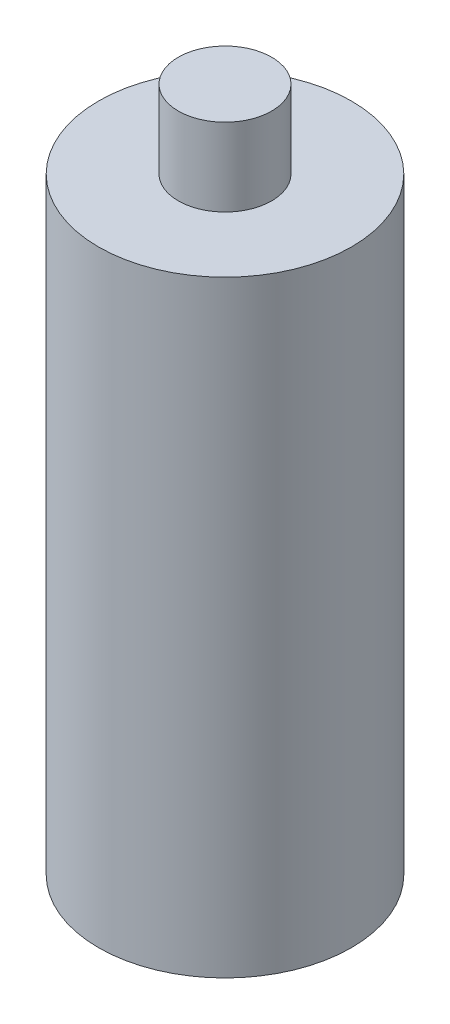
from build123d import *

# Parameters (mm, degrees)
SKETCH_1_R      = 3.25
EXTRUDE_1_DEPTH = 15.6
SKETCH_2_R      = 1.2
EXTRUDE_2_DEPTH = 2


with BuildPart() as part:
    # 草图1 → 凸台-拉伸1 (new body)
    with BuildSketch(Plane(origin=(0, 0, 0), x_dir=(1, 0, 0), z_dir=(0, 1, 0))):
        with Locations(Location((0, 0, 0), (0, 0, 270))):
            Circle(SKETCH_1_R)
    extrude(amount=EXTRUDE_1_DEPTH)

    # 草图2 → 凸台-拉伸2 (add)
    with BuildSketch(Plane(origin=(0, 15.6, 0), x_dir=(1, 0, 0), z_dir=(0, 1, 0))):
        with Locations(Location((0, 0, 0), (0, 0, 270))):
            Circle(SKETCH_2_R)
    extrude(amount=EXTRUDE_2_DEPTH)


solid = part.part
